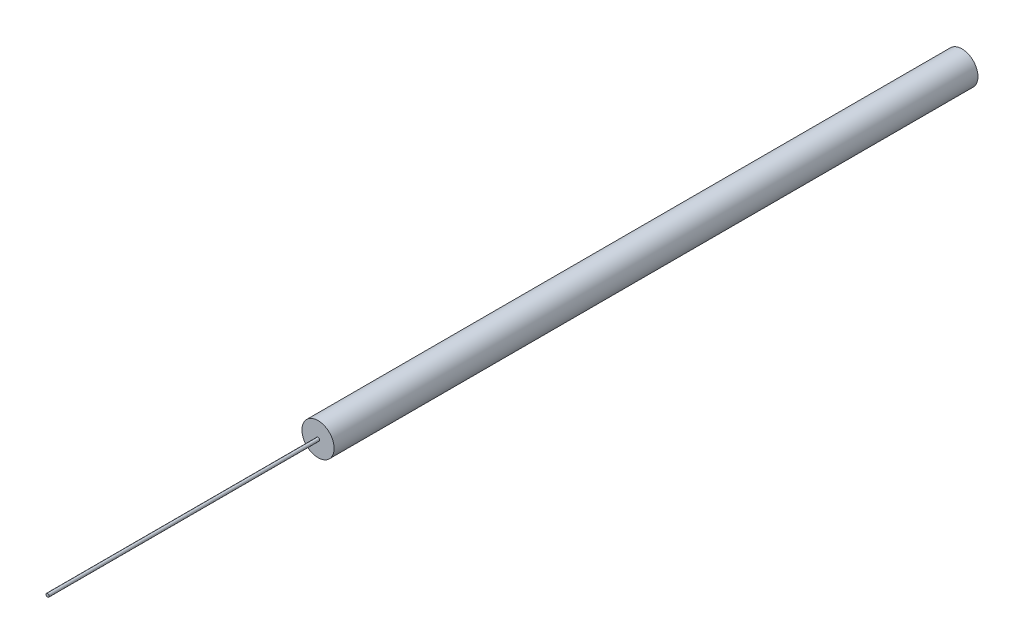
from build123d import *

# Parameters (mm, degrees)
SKETCH_1_R      = 5
EXTRUDE_1_DEPTH = 200
SKETCH_2_R      = 0.5
EXTRUDE_2_DEPTH = 84


with BuildPart() as part:
    # 草图1 → 凸台-拉伸1 (new body)
    with BuildSketch(Plane.XY):
        Circle(SKETCH_1_R)
    extrude(amount=EXTRUDE_1_DEPTH)

    # 草图2 → 凸台-拉伸2 (add)
    with BuildSketch(Plane.XY.offset(200)):
        Circle(SKETCH_2_R)
    extrude(amount=EXTRUDE_2_DEPTH)


solid = part.part
